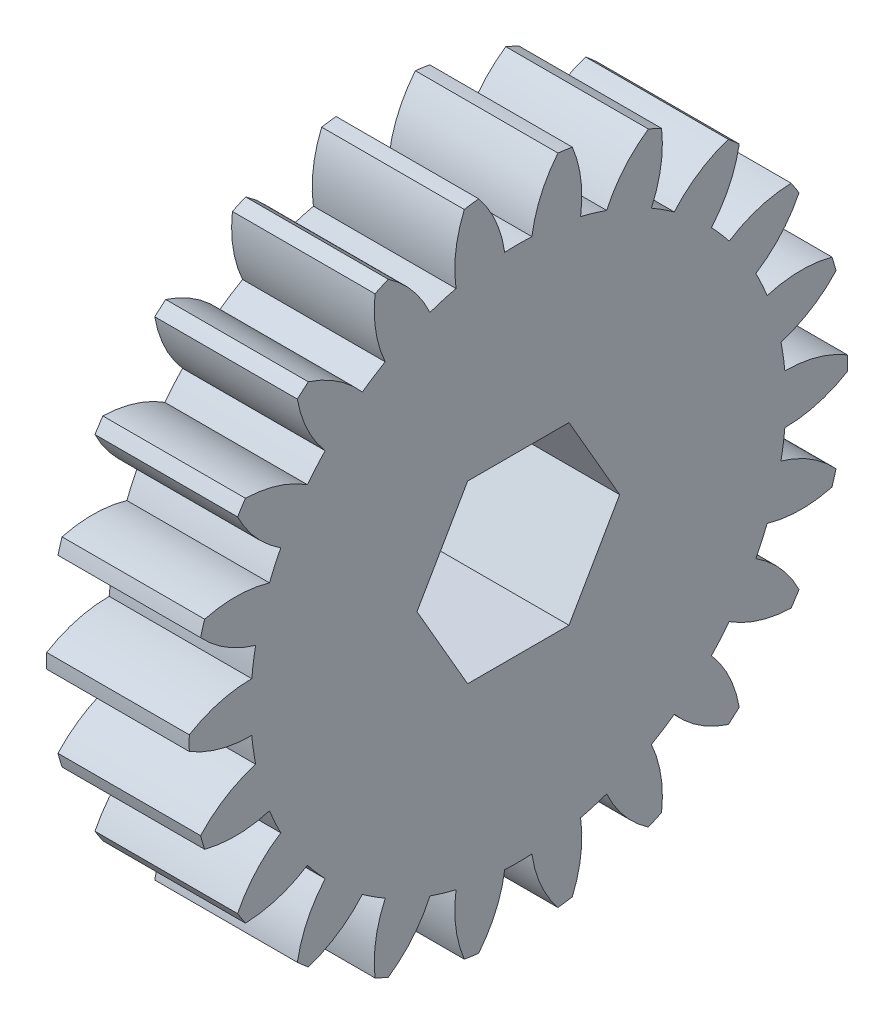
from build123d import *

# Parameters (mm, degrees)
BASPROSKE_W         = 6.604
BASPROSKE_H         = 15.24
TOOTHCUT_DEPTH      = 23.541695056
TEETHCUTS_COUNT     = 22
TEETHCUTS_ANGLE     = 343.636363636
BORSKE_R            = 0.499999
BORE_DEPTH          = 50.8000508
SKETCH1_R           = 6.985
BOSS_EXTRUDE1_DEPTH = 2.286
CUT_EXTRUDE1_DEPTH  = 24.241702632


with BuildPart() as part:
    # BasProSke → Base-Revolve (revolve)
    with BuildSketch(Plane(origin=(0, 0, 0), x_dir=(1, 0, 0), z_dir=(0, 1, 0)), mode=Mode.PRIVATE) as base_revolve_sk:
        with Locations((3.302, 7.62)):
            Rectangle(BASPROSKE_W, BASPROSKE_H)
    revolve(base_revolve_sk.sketch.rotate(Axis((-10, 0, 0), (1, 0, 0)), 180), axis=Axis((-10, 0, 0), (1, 0, 0)))

    # TooCutSke → ToothCut (cut, through all)
    with BuildSketch(Plane(origin=(0, 0, 0), x_dir=(0, 0, -1), z_dir=(1, 0, 0))):
        with BuildLine():
            ThreePointArc((0.629474743, 12.379206137), (0, 12.3952), (-0.629474743, 12.379206137))
            ThreePointArc((-0.629474743, 12.379206137), (-1.05059125, 13.850443254), (-1.855031489, 15.152270303))
            ThreePointArc((-1.855031489, 15.152270303), (0, 15.2654), (1.855031489, 15.152270303))
            ThreePointArc((1.855031489, 15.152270303), (1.05059125, 13.850443254), (0.629474743, 12.379206137))
        make_face()
    toothcut = extrude(amount=TOOTHCUT_DEPTH, mode=Mode.SUBTRACT)

    # TeethCuts: ToothCut ×22 about axis
    teethcuts_axis = Axis((-10, 0, 0), (1, 0, 0))
    for i in range(1, TEETHCUTS_COUNT):
        add(toothcut.rotate(teethcuts_axis, i * TEETHCUTS_ANGLE / (TEETHCUTS_COUNT - 1)), mode=Mode.SUBTRACT)

    # BorSke → Bore (cut, symmetric)
    with BuildSketch(Plane(origin=(0, 0, 0), x_dir=(0, 0, -1), z_dir=(1, 0, 0))):
        with Locations(Location((0, 0, 0), (0, 0, 180))):
            Circle(BORSKE_R)
    extrude(amount=BORE_DEPTH, both=True, mode=Mode.SUBTRACT)

    # Sketch1 → Boss-Extrude1 (add)
    with BuildSketch(Plane.ZY):
        with Locations(Location((0, 0, 0), (0, 0, 180))):
            Circle(SKETCH1_R)
    extrude(amount=BOSS_EXTRUDE1_DEPTH)

    # Sketch2 → Cut-Extrude1 (cut, through all)
    with BuildSketch(Plane(origin=(6.604, 0, 0), x_dir=(0, 0, -1), z_dir=(1, 0, 0))):
        Polygon((2.346351494, 4.064), (-2.346351494, 4.064), (-4.692702988, 0), (-2.346351494, -4.064), (2.346351494, -4.064), (4.692702988, 0), align=None)
    extrude(amount=-CUT_EXTRUDE1_DEPTH, mode=Mode.SUBTRACT)


solid = part.part
